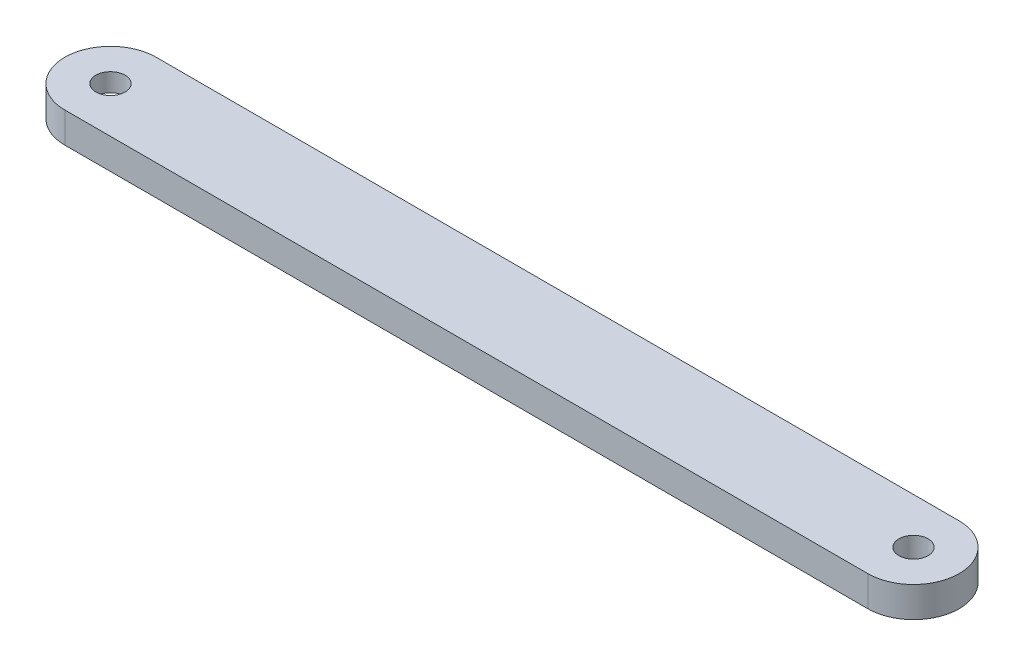
from build123d import *

# Parameters (mm, degrees)
SKETCH1_R           = 2.4
BOSS_EXTRUDE1_DEPTH = 5
SKETCH2_R           = 5.9
CUT_EXTRUDE1_DEPTH  = 2
SCALE1_SCALE        = 0.8


with BuildPart() as part:
    # Sketch1 → Boss-Extrude1 (new body)
    with BuildSketch(Plane(origin=(0, 0, 0), x_dir=(1, 0, 0), z_dir=(0, 1, 0))):
        with BuildLine():
            Line((-181.84579044, 7.5), (-50, 7.5))
            ThreePointArc((-50, 7.5), (-42.5, 0), (-50, -7.5))
            Line((-50, -7.5), (-181.84579044, -7.5))
            ThreePointArc((-181.84579044, -7.5), (-189.34579044, 0), (-181.84579044, 7.5))
        make_face()
        with Locations(Location((-181.84579044, 0, 0), (0, 0, 270))):
            Circle(SKETCH1_R, mode=Mode.SUBTRACT)
        with Locations(Location((-50, 0, 0), (0, 0, 270))):
            Circle(SKETCH1_R, mode=Mode.SUBTRACT)
    extrude(amount=BOSS_EXTRUDE1_DEPTH)

    # Sketch2 → Cut-Extrude1 (cut)
    with BuildSketch(Plane.XZ):
        with Locations(Location((-181.84579044, 0, 0), (0, 0, 270))):
            Circle(SKETCH2_R)
    extrude(amount=-CUT_EXTRUDE1_DEPTH, mode=Mode.SUBTRACT)


with BuildPart() as part_1:
    # Scale1: scaled about (-114.766854611, 2.52630438, 0)
    add(part.part.scale(SCALE1_SCALE).moved(Location((-22.953370922, 0.505260876, 0))))


solid = part_1.part
